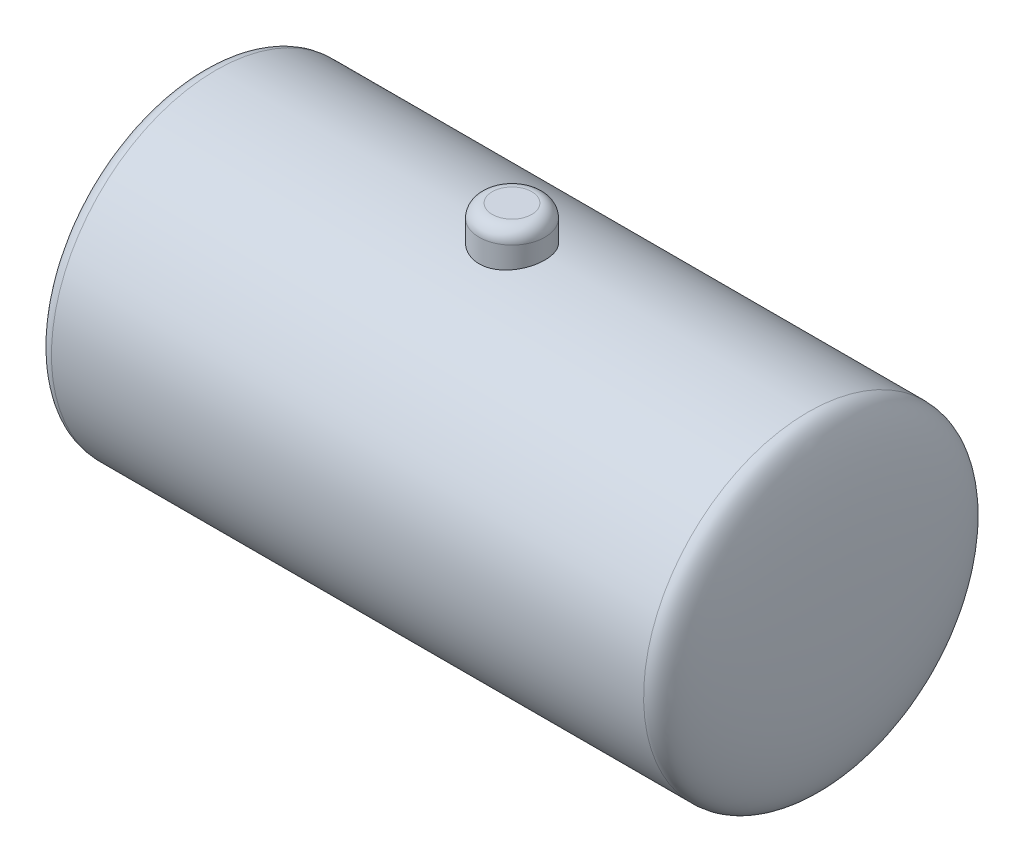
from build123d import *

# Parameters (mm, degrees)
SKETCH1_R           = 25
BOSS_EXTRUDE1_DEPTH = 45
SKETCH3_R           = 5
BOSS_EXTRUDE2_DEPTH = 30
FILLET1_R           = 2
SKETCH4_R           = 2.5
BOSS_EXTRUDE3_DEPTH = 30
CHAMFER1_SIZE       = 1


with BuildPart() as part:
    # Sketch1 → Boss-Extrude1 (new, symmetric)
    with BuildSketch(Plane(origin=(0, 0, 0), x_dir=(0, 0, -1), z_dir=(1, 0, 0))):
        Circle(SKETCH1_R)
    extrude(amount=BOSS_EXTRUDE1_DEPTH, both=True)

    # Sketch2 → Revolve1 (revolve)
    with BuildSketch(Plane.XY):
        with BuildLine():
            Line((-45, 0), (-45, 25))
            add(Edge.make_bspline(
                [(-45, 25), (-50, 25), (-50, 0)],
                knots=[0, 0, 0, 1, 1, 1], degree=2))
            Line((-50, 0), (-45, 0))
        make_face()
    revolve(axis=Axis((-45, 0, 0), (-1, 0, 0)))

    # Sketch2<4> → Revolve2 (revolve)
    with BuildSketch(Plane.XY):
        with BuildLine():
            Line((45, 25), (45, 0))
            Line((45, 0), (50, 0))
            add(Edge.make_bspline(
                [(45, 25), (50, 25), (50, 0)],
                knots=[0, 0, 0, 1, 1, 1], degree=2))
        make_face()
    revolve(axis=Axis((45, 0, 0), (1, 0, 0)))

    # Sketch3 → Boss-Extrude2 (add)
    with BuildSketch(Plane(origin=(0, 0, 0), x_dir=(1, 0, 0), z_dir=(0, 1, 0))):
        Circle(SKETCH3_R)
    extrude(amount=BOSS_EXTRUDE2_DEPTH)

    # Fillet1
    fillet1_edges = [part.edges().sort_by_distance(p)[0] for p in [
        (-5, 30, 0),
    ]]
    fillet(fillet1_edges, radius=FILLET1_R)

    # Sketch4 → Boss-Extrude3 (add)
    with BuildSketch(Plane(origin=(0, 0, 0), x_dir=(1, 0, 0), z_dir=(0, 1, 0))):
        with Locations((-25, 0)):
            Circle(SKETCH4_R)
        with Locations((25, 0)):
            Circle(SKETCH4_R)
    extrude(amount=-BOSS_EXTRUDE3_DEPTH)

    # Chamfer1
    chamfer1_edges = [part.edges().sort_by_distance(p)[0] for p in [
        (22.5, -30, 0),
        (-27.5, -30, 0),
    ]]
    chamfer(chamfer1_edges, length=CHAMFER1_SIZE)


solid = part.part
